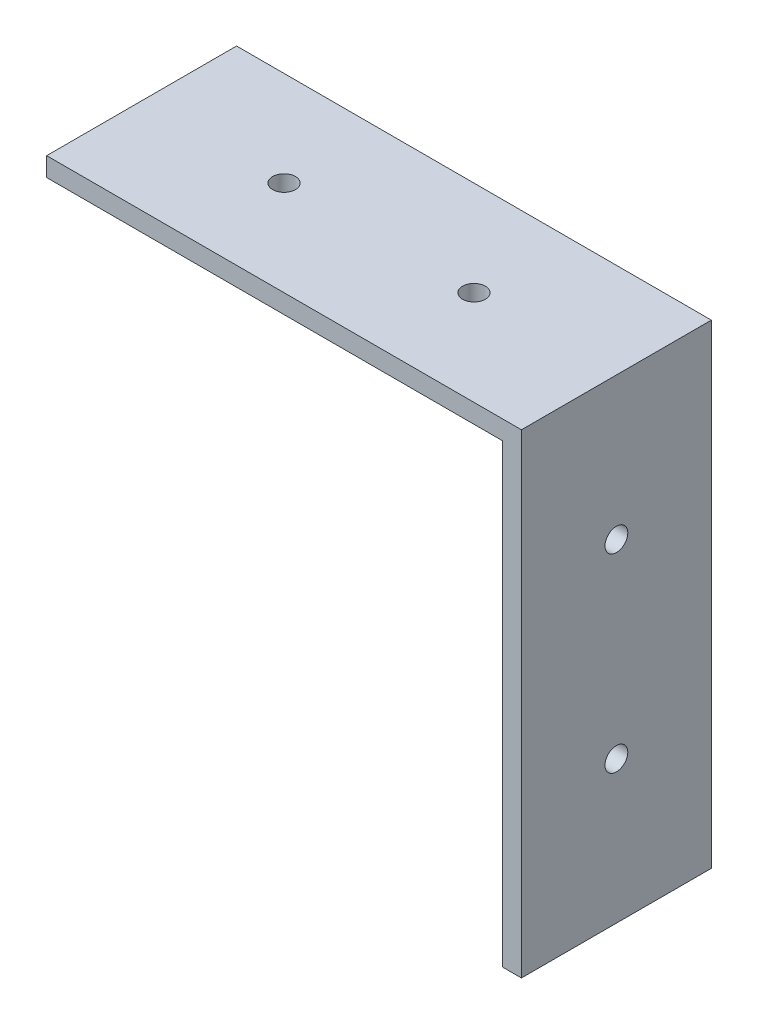
from build123d import *

# Parameters (mm, degrees)
BOSS_EXTRUDE1_DEPTH                = 20
M2_CLEARANCE_HOLE1_D               = 2.4
M2_CLEARANCE_HOLE1_DEPTH           = 3
M2_CLEARANCE_HOLE1_TIP             = 0.721032743
M2_CLEARANCE_HOLE1_ON_FACE_2_D     = 2.4
M2_CLEARANCE_HOLE1_ON_FACE_2_DEPTH = 3
M2_CLEARANCE_HOLE1_ON_FACE_2_TIP   = 0.721032743


with BuildPart() as part:
    # Sketch1 → Boss-Extrude1 (new body)
    with BuildSketch(Plane.XY):
        Polygon((-50, 0), (-50, -2), (-2, -2), (-2, -50), (0, -50), (0, 0), align=None)
    extrude(amount=BOSS_EXTRUDE1_DEPTH)

    # M2 Clearance Hole1
    with Locations(Plane(origin=(-35, 0, 10), x_dir=(1, 0, 0), z_dir=(0, 1, 0))):
        with Locations((0, 0), (20, 0)):
            Hole(M2_CLEARANCE_HOLE1_D / 2, depth=M2_CLEARANCE_HOLE1_DEPTH)
            with Locations((0, 0, -(M2_CLEARANCE_HOLE1_DEPTH + M2_CLEARANCE_HOLE1_TIP / 2))):  # 118° drill point
                Cone(0, M2_CLEARANCE_HOLE1_D / 2, M2_CLEARANCE_HOLE1_TIP, mode=Mode.SUBTRACT)

    # M2 Clearance Hole1 on face 2
    with Locations(Plane(origin=(0, -15, 10), x_dir=(0, 0, 1), z_dir=(1, 0, 0))):
        with Locations((0, 0), (0, 20)):
            Hole(M2_CLEARANCE_HOLE1_ON_FACE_2_D / 2, depth=M2_CLEARANCE_HOLE1_ON_FACE_2_DEPTH)
            with Locations((0, 0, -(M2_CLEARANCE_HOLE1_ON_FACE_2_DEPTH + M2_CLEARANCE_HOLE1_ON_FACE_2_TIP / 2))):  # 118° drill point
                Cone(0, M2_CLEARANCE_HOLE1_ON_FACE_2_D / 2, M2_CLEARANCE_HOLE1_ON_FACE_2_TIP, mode=Mode.SUBTRACT)


solid = part.part
